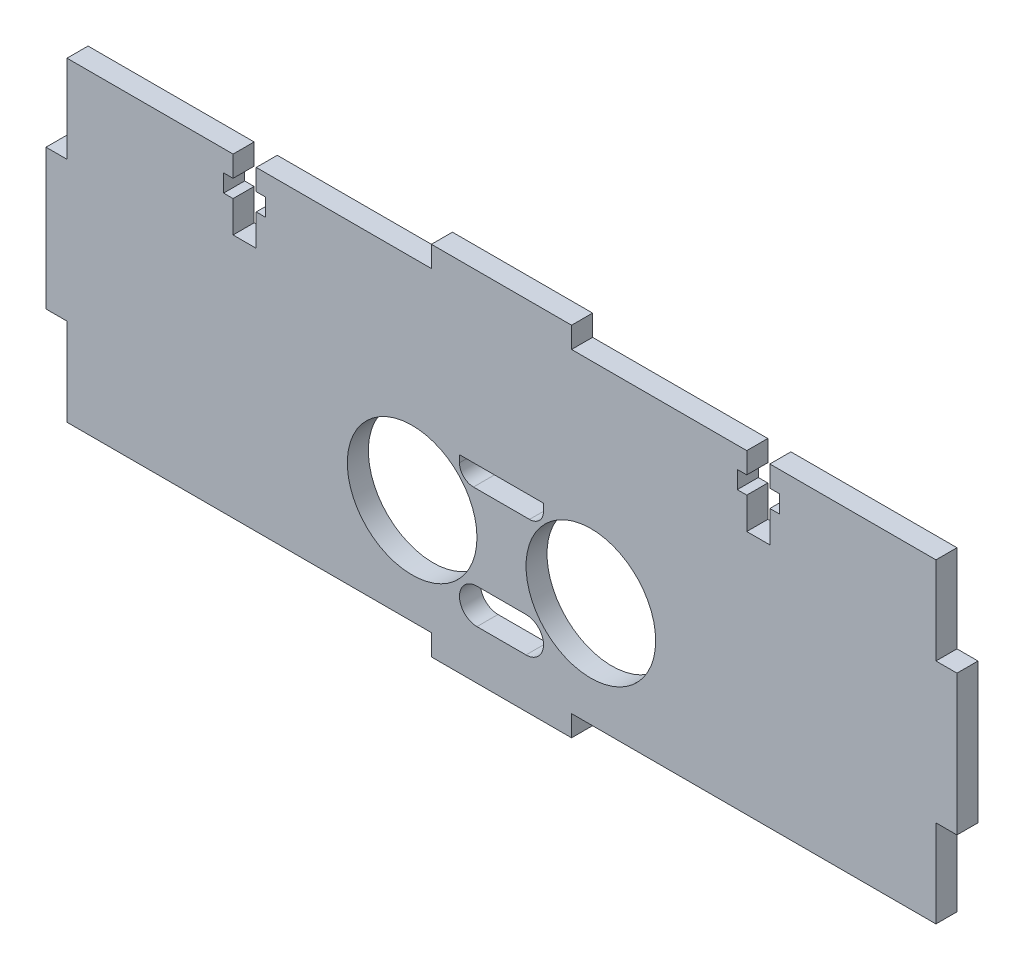
from build123d import *

# Parameters (mm, degrees)
SKETCH1_R           = 9.25
BOSS_EXTRUDE1_DEPTH = 3


with BuildPart() as part:
    # Sketch1 → Boss-Extrude1 (new body)
    with BuildSketch(Plane.XY):
        Polygon((10, -22.5), (62, -22.5), (62, -10), (65, -10), (65, 10), (62, 10), (62, 22.5), (38.3, 22.5), (38.3, 19.5), (39.65, 19.5), (39.65, 17), (38.3, 17), (38.3, 12.5), (35, 12.5), (35, 17), (33.65, 17), (33.65, 19.5), (35, 19.5), (35, 22.5), (10, 22.5), (10, 25.5), (-10, 25.5), (-10, 22.5), (-35, 22.5), (-35, 19.5), (-33.65, 19.5), (-33.65, 17), (-35, 17), (-35, 12.5), (-38.3, 12.5), (-38.3, 17), (-39.65, 17), (-39.65, 19.5), (-38.3, 19.5), (-38.3, 22.5), (-62, 22.5), (-62, 10), (-65, 10), (-65, -10), (-62, -10), (-62, -22.5), (-10, -22.5), (-10, -25.5), (10, -25.5), align=None)
        with Locations((-12.75, -7.5)):
            Circle(SKETCH1_R, mode=Mode.SUBTRACT)
        with BuildLine():
            ThreePointArc((-3.5, -18.5), (-6, -16), (-3.5, -13.5))
            Line((-3.5, -13.5), (3.5, -13.5))
            ThreePointArc((3.5, -13.5), (6, -16), (3.5, -18.5))
            Line((3.5, -18.5), (-3.5, -18.5))
        make_face(mode=Mode.SUBTRACT)
        with Locations((12.75, -7.5)):
            Circle(SKETCH1_R, mode=Mode.SUBTRACT)
        with BuildLine():
            ThreePointArc((6, 0.5), (5.414213562, -0.914213562), (4, -1.5))
            Line((4, -1.5), (-4, -1.5))
            ThreePointArc((-4, -1.5), (-5.414213562, -0.914213562), (-6, 0.5))
            Line((-6, 0.5), (-6, 1.5))
            Line((-6, 1.5), (6, 1.5))
            Line((6, 1.5), (6, 0.5))
        make_face(mode=Mode.SUBTRACT)
    extrude(amount=BOSS_EXTRUDE1_DEPTH)


solid = part.part
